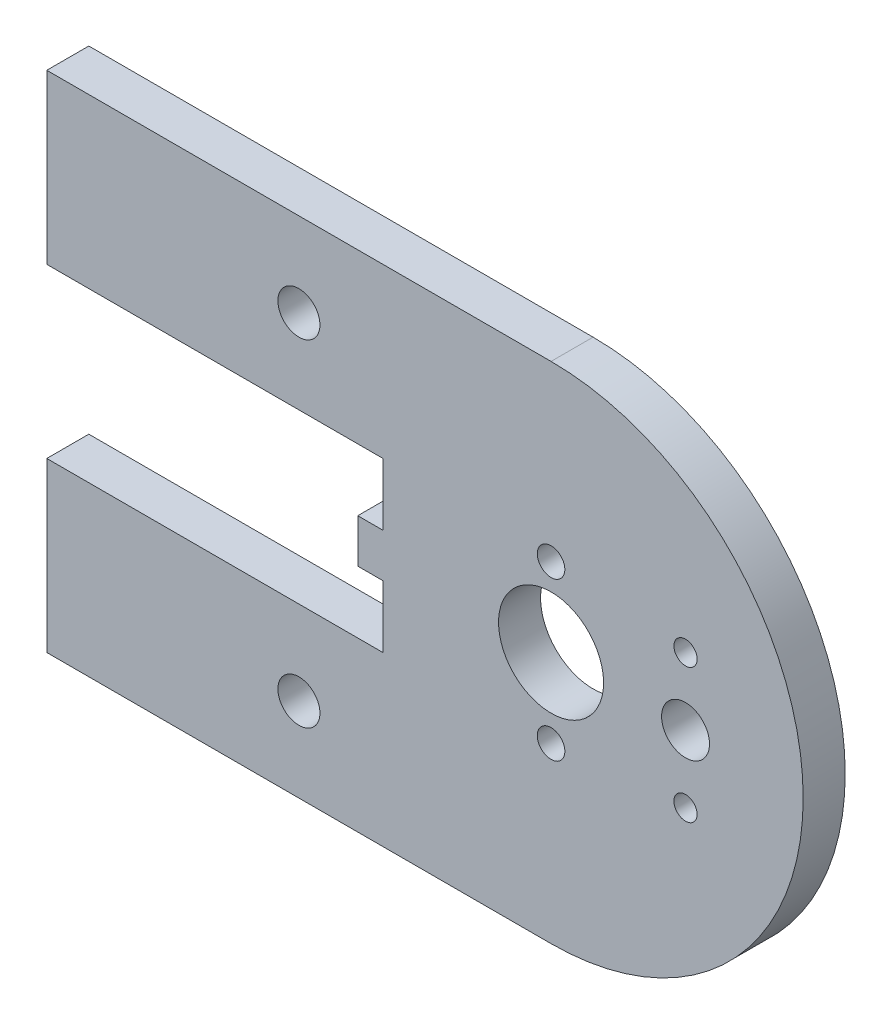
from build123d import *

# Parameters (mm, degrees)
BOSS_EXTRUDE1_DEPTH   = 6.35
SKETCH2_W             = 50.8
SKETCH2_H             = 25.4
CUT_EXTRUDE1_DEPTH    = 86.430512699
SKETCH5_R             = 7.9375
SKETCH5_R_2           = 2.0828
CUT_EXTRUDE4_DEPTH    = 86.430512699
SKETCH4_R             = 3.175
CUT_EXTRUDE5_DEPTH    = 86.430512699
SKETCH6_W             = 6.35
SKETCH6_H             = 6.604
BOSS_EXTRUDE2_DEPTH   = 3.81
CUT_EXTRUDE7_REACH    = 87.431
SKETCH8_R             = 3.6195
F_6_CLEARANCE_HOLE1_D = 3.5052


with BuildPart() as part:
    # Sketch1 → Boss-Extrude1 (new body)
    with BuildSketch(Plane.XY):
        with BuildLine():
            Line((-38.1, -38.1), (38.1, -38.1))
            ThreePointArc((38.1, -38.1), (76.2, 0), (38.1, 38.1))
            Line((38.1, 38.1), (-38.1, 38.1))
            Line((-38.1, 38.1), (-38.1, -38.1))
        make_face()
    extrude(amount=BOSS_EXTRUDE1_DEPTH)

    # Sketch2 → Cut-Extrude1 (cut, through all)
    with BuildSketch(Plane.XY.offset(6.35)):
        with Locations((-12.7, 0)):
            Rectangle(SKETCH2_W, SKETCH2_H)
    extrude(amount=-CUT_EXTRUDE1_DEPTH, mode=Mode.SUBTRACT)

    # Sketch5 → Cut-Extrude4 (cut, through all)
    with BuildSketch(Plane.XY.offset(6.35)):
        with Locations((38.1, 0)):
            Circle(SKETCH5_R)
        with Locations((38.1, 11.8999)):
            Circle(SKETCH5_R_2)
        with Locations((38.1, -11.8999)):
            Circle(SKETCH5_R_2)
    extrude(amount=-CUT_EXTRUDE4_DEPTH, mode=Mode.SUBTRACT)

    # Sketch4 → Cut-Extrude5 (cut, through all)
    with BuildSketch(Plane.XY.offset(6.35)):
        with Locations((0, -25.4)):
            Circle(SKETCH4_R)
    cut_extrude5 = extrude(amount=-CUT_EXTRUDE5_DEPTH, mode=Mode.SUBTRACT)

    # Mirror3: Cut-Extrude5 across plane
    add(cut_extrude5.mirror(Plane.ZX), mode=Mode.SUBTRACT)

    # Sketch6 → Boss-Extrude2 (add)
    with BuildSketch(Plane.ZY.offset(-12.7)):
        with Locations((3.175, 0)):
            Rectangle(SKETCH6_W, SKETCH6_H)
    extrude(amount=BOSS_EXTRUDE2_DEPTH)

    # Sketch8 → Cut-Extrude7 (cut, up to next)
    with BuildSketch(Plane.XY.offset(6.35), mode=Mode.PRIVATE) as cut_extrude7_sk1:
        with Locations((58.42, 0)):
            Circle(SKETCH8_R)
    cut_extrude7_tool1 = extrude(cut_extrude7_sk1.sketch, amount=-CUT_EXTRUDE7_REACH, mode=Mode.PRIVATE) & part.part
    add(cut_extrude7_tool1.solids().sort_by_distance((58.42, 0, 6.35))[0], mode=Mode.SUBTRACT)

    # #6 Clearance Hole1 (through all)
    with Locations(Plane(origin=(0, 0, 0), x_dir=(-1, 0, 0), z_dir=(0, 0, -1))):
        with Locations((-58.42, 10.16), (-58.42, -10.16)):
            Hole(F_6_CLEARANCE_HOLE1_D / 2)


solid = part.part
